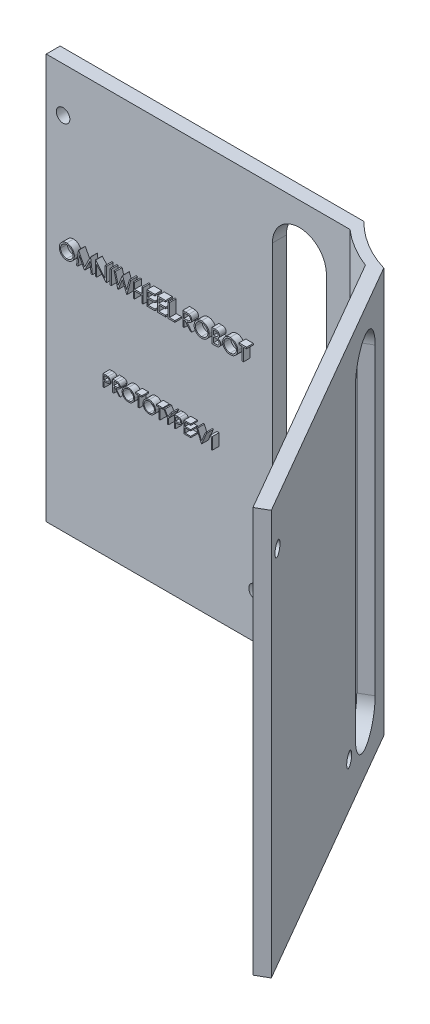
from build123d import *

# Parameters (mm, degrees)
BOSS_EXTRU_1_DEPTH      = 120
ENL_V_MAT_EXTRU_1_DEPTH = 188.009777727
ENL_V_MAT_EXTRU_2_DEPTH = 180.784310366
ESQUISSE6_R             = 2
ENL_V_MAT_EXTRU_3_DEPTH = 188.009777727
ESQUISSE7_R             = 2
ENL_V_MAT_EXTRU_4_DEPTH = 180.784310366
ESQUISSE8_W             = 0.379914529
ESQUISSE8_H             = 4.233333333
BOSS_EXTRU_2_DEPTH      = 2
ESQUISSE9_R             = 2
ENL_V_MAT_EXTRU_5_DEPTH = 188.009777853
ESQUISSE10_R            = 2
ENL_V_MAT_EXTRU_6_DEPTH = 180.784310483


with BuildPart() as part:
    # Esquisse3 → Boss.-Extru.1 (new body)
    with BuildSketch(Plane(origin=(0, 0, 0), x_dir=(1, 0, 0), z_dir=(0, 1, 0))):
        with BuildLine():
            ThreePointArc((-25, -28.618176043), (-27.104360033, -26.633694209), (-29.051678093, -24.494897428))
            Line((-29.051678093, -24.494897428), (-115, -24.494897428))
            Line((-115, -24.494897428), (-115, -28.618176043))
            Line((-115, -28.618176043), (-25, -28.618176043))
        make_face()
        with BuildLine():
            ThreePointArc((-10.103808925, -33.509894736), (-18.121448463, -29.943498553), (-25, -24.494897428))
            Line((-25, -24.494897428), (-29.051678093, -24.494897428))
            ThreePointArc((-29.051678093, -24.494897428), (-27.104360033, -26.633694209), (-25, -28.618176043))
            ThreePointArc((-25, -28.618176043), (-19.581111, -32.566548666), (-13.552631037, -35.50107311))
            ThreePointArc((-13.552631037, -35.50107311), (-10.809506446, -36.430132725), (-8.003591765, -37.147577564))
            Line((-8.003591765, -37.147577564), (-10.103808925, -33.509894736))
        make_face()
        with BuildLine():
            Line((35.411933246, -112.345472721), (-8.003591765, -37.147577564))
            ThreePointArc((-8.003591765, -37.147577564), (-10.809506446, -36.430132725), (-13.552631037, -35.50107311))
            Line((-13.552631037, -35.50107311), (31.963111135, -114.336651096))
            Line((31.963111135, -114.336651096), (35.411933246, -112.345472721))
        make_face()
    extrude(amount=BOSS_EXTRU_1_DEPTH)

    # Esquisse4 → Enlèv. mat.-Extru.1 (cut, through all)
    with BuildSketch(Plane.XY.offset(28.618176043)):
        with BuildLine():
            Line((-48, 105), (-48, 15))
            ThreePointArc((-48, 15), (-40, 7), (-32, 15))
            Line((-32, 15), (-32, 105))
            ThreePointArc((-32, 105), (-40, 113), (-48, 105))
        make_face()
    extrude(amount=-ENL_V_MAT_EXTRU_1_DEPTH, mode=Mode.SUBTRACT)

    # Esquisse5 → Enlèv. mat.-Extru.2 (cut, through all)
    with BuildSketch(Plane(origin=(-25.536888865, 0, 14.743729661), x_dir=(0.4999999999999999, 0, 0.8660254037844386), z_dir=(-0.8660254037844387, 0, 0.49999999999999994))):
        with BuildLine():
            Line((46.968515657, 105), (46.968515657, 15))
            ThreePointArc((46.968515657, 15), (38.968515657, 7), (30.968515657, 15))
            Line((30.968515657, 15), (30.968515657, 105))
            ThreePointArc((30.968515657, 105), (38.968515657, 113), (46.968515657, 105))
        make_face()
    extrude(amount=-ENL_V_MAT_EXTRU_2_DEPTH, mode=Mode.SUBTRACT)

    # Esquisse6 → Enlèv. mat.-Extru.3 (cut, through all)
    with BuildSketch(Plane.XY.offset(28.618176043)):
        with Locations((-110, 106.75)):
            Circle(ESQUISSE6_R)
    extrude(amount=-ENL_V_MAT_EXTRU_3_DEPTH, mode=Mode.SUBTRACT)

    # Esquisse7 → Enlèv. mat.-Extru.4 (cut, through all)
    with BuildSketch(Plane(origin=(-25.536888865, 0, 14.743729661), x_dir=(0.4999999999999999, 0, 0.8660254037844386), z_dir=(-0.8660254037844387, 0, 0.49999999999999994))):
        with Locations((110, 106.75)):
            Circle(ESQUISSE7_R)
    extrude(amount=-ENL_V_MAT_EXTRU_4_DEPTH, mode=Mode.SUBTRACT)

    # Esquisse8 → Boss.-Extru.2 (add)
    # profile 1 of 25: a face of its own
    with BuildSketch(Plane.XY.offset(28.618176043)):
        with BuildLine():
            add(Edge.make_bspline(
                [(-106.927136752, 76.562203816), (-106.848749805, 76.560218407), (-106.694791374, 76.556318902), (-106.468519831, 76.526468938), (-106.252504811, 76.474827848), (-106.044986643, 76.406050716), (-105.848447519, 76.314303031), (-105.661408096, 76.203407661), (-105.484313401, 76.072202802), (-105.319550397, 75.921702689), (-105.168774848, 75.757953178), (-105.035937823, 75.583203706), (-104.924610477, 75.398510869), (-104.833187668, 75.204429674), (-104.761464588, 75.001399046), (-104.71197203, 74.788336585), (-104.680357315, 74.566622779), (-104.67666128, 74.41539981), (-104.674786325, 74.338686188)],
                knots=[0, 0, 0, 0, 1.065120563, 2.091984664, 3.0946048, 4.079830382, 5.057816894, 6.036188127, 7.030412546, 8.04752943, 9.064399622, 10.05169764, 11.02544977, 11.989514704, 12.962713494, 13.945757189, 14.957906945, 16, 16, 16, 16], degree=3))
            add(Edge.make_bspline(
                [(-104.674786325, 74.338686188), (-104.676661005, 74.262537657), (-104.680356217, 74.112440082), (-104.712007977, 73.89213325), (-104.761648043, 73.680356883), (-104.832521622, 73.477464522), (-104.92350863, 73.283242136), (-105.035577265, 73.098200773), (-105.167586158, 72.92227977), (-105.317817302, 72.757406356), (-105.481588086, 72.606218939), (-105.657247552, 72.474478965), (-105.840845186, 72.361117405), (-106.034743595, 72.270664771), (-106.236371259, 72.19836921), (-106.447532735, 72.149077934), (-106.667238567, 72.117283129), (-106.817063496, 72.113632162), (-106.893215812, 72.111776465)],
                knots=[0, 0, 0, 0, 1.043624062, 2.057103931, 3.04512605, 4.022047818, 4.998200453, 5.980619268, 6.982898556, 8.009068085, 9.034988726, 10.034168286, 11.015286542, 11.987931943, 12.962482838, 13.94673481, 14.956375938, 16, 16, 16, 16], degree=3))
            add(Edge.make_bspline(
                [(-106.893215812, 72.111776465), (-106.969929036, 72.113650486), (-107.121151221, 72.117344679), (-107.343143635, 72.149011711), (-107.556355763, 72.198531193), (-107.760177883, 72.269299749), (-107.954723655, 72.36076059), (-108.140373565, 72.472283982), (-108.316382438, 72.604614524), (-108.481291027, 72.754796952), (-108.632178152, 72.918290163), (-108.763725207, 73.093470643), (-108.875273677, 73.276901528), (-108.966427422, 73.469091867), (-109.038593006, 73.669112564), (-109.087826453, 73.878297866), (-109.119680414, 74.095455173), (-109.123351133, 74.243310869), (-109.125213675, 74.318333624)],
                knots=[0, 0, 0, 0, 1.053102029, 2.075944431, 3.073151272, 4.055350789, 5.033113405, 6.020478099, 7.024410459, 8.052272461, 9.079885166, 10.07527673, 11.055994387, 12.023226415, 12.992069828, 13.970394897, 14.97016774, 16, 16, 16, 16], degree=3))
            add(Edge.make_bspline(
                [(-109.125213675, 74.318333624), (-109.124567021, 74.368689328), (-109.12328187, 74.468765478), (-109.107810013, 74.617375556), (-109.085359194, 74.763595685), (-109.053183547, 74.907010069), (-109.011102198, 75.047267641), (-108.961448793, 75.185335707), (-108.900803456, 75.319815068), (-108.832246863, 75.451342789), (-108.7557302, 75.577868542), (-108.671213817, 75.697465752), (-108.581666276, 75.811138006), (-108.483497219, 75.91593962), (-108.37994209, 76.014919375), (-108.269321004, 76.106556186), (-108.152308956, 76.191676364), (-108.028402459, 76.268384777), (-107.900654641, 76.337762016), (-107.768965586, 76.397297017), (-107.635123828, 76.448394634), (-107.498502492, 76.489809727), (-107.359464377, 76.522505618), (-107.217706028, 76.544769751), (-107.073340379, 76.560281069), (-106.976080974, 76.561560143), (-106.927136752, 76.562203816)],
                knots=[0, 0, 0, 0, 1.037015668, 2.060948919, 3.074880161, 4.083647147, 5.086022904, 6.090072063, 7.104153813, 8.122640571, 9.144368836, 10.147691507, 11.138137339, 12.123020368, 13.103399296, 14.087645067, 15.080126199, 16.082011238, 17.087798457, 18.072939717, 19.057185487, 20.037253025, 21.01195951, 21.997135196, 22.992090687, 24, 24, 24, 24], degree=3))
        make_face()
        with BuildLine():
            add(Edge.make_bspline(
                [(-106.908480235, 76.128015782), (-106.948654125, 76.127526057), (-107.02861784, 76.12655129), (-107.147495327, 76.11371133), (-107.26480938, 76.095411369), (-107.380584228, 76.069308005), (-107.494335454, 76.033743103), (-107.607123357, 75.992811719), (-107.717919432, 75.942953829), (-107.826357907, 75.886623034), (-107.93148376, 75.824273387), (-108.030680075, 75.755364678), (-108.124203654, 75.681512903), (-108.21182551, 75.602545709), (-108.293288356, 75.518060953), (-108.370195567, 75.429339435), (-108.439464489, 75.333845243), (-108.502947044, 75.234167894), (-108.559755765, 75.130437219), (-108.610271956, 75.02374529), (-108.651594138, 74.913221803), (-108.685294346, 74.800065822), (-108.713234117, 74.684456561), (-108.730934197, 74.56551701), (-108.743915241, 74.443844827), (-108.744834292, 74.361619156), (-108.745299145, 74.320029671)],
                knots=[0, 0, 0, 0, 1.008559885, 2.007477868, 2.99961109, 3.989939068, 4.984837346, 5.991145699, 7.001802488, 8.033829008, 9.059044045, 10.069351652, 11.065060232, 12.050310815, 13.029377138, 14.011219647, 14.996725999, 15.989392538, 16.977580475, 17.965360261, 18.951710183, 19.937753436, 20.929683414, 21.935841486, 22.955955122, 24, 24, 24, 24], degree=3))
            add(Edge.make_bspline(
                [(-108.745299145, 74.320029671), (-108.743757169, 74.258873461), (-108.740723626, 74.138560276), (-108.714165422, 73.962250236), (-108.673256939, 73.792810118), (-108.612953267, 73.631167047), (-108.537538714, 73.475931581), (-108.444372856, 73.328480826), (-108.333992819, 73.18877493), (-108.208609316, 73.057789224), (-108.071542804, 72.93823287), (-107.925997502, 72.833290461), (-107.773532662, 72.744499016), (-107.613750693, 72.672163357), (-107.447504622, 72.614844341), (-107.273723203, 72.575560664), (-107.093564076, 72.549706541), (-106.970760331, 72.547223684), (-106.908480235, 72.5459645)],
                knots=[0, 0, 0, 0, 1.032063989, 2.030389145, 3.003944642, 3.970395727, 4.937377036, 5.913328081, 6.909231446, 7.93887556, 8.970685674, 9.976071282, 10.964166581, 11.944589148, 12.933237628, 13.927779006, 14.949070134, 16, 16, 16, 16], degree=3))
            add(Edge.make_bspline(
                [(-106.908480235, 72.5459645), (-106.866619219, 72.546539633), (-106.783596251, 72.547680297), (-106.660109286, 72.559169172), (-106.538847011, 72.577592481), (-106.41997951, 72.604118131), (-106.303641691, 72.637316181), (-106.189347977, 72.676756004), (-106.078315759, 72.725960889), (-105.969144336, 72.780326506), (-105.864646025, 72.842302697), (-105.764889905, 72.908872649), (-105.672390386, 72.982615648), (-105.584834081, 73.060409573), (-105.503036781, 73.143822989), (-105.427551628, 73.232747448), (-105.358632802, 73.327744243), (-105.295174353, 73.427270401), (-105.238564692, 73.531284916), (-105.189241401, 73.638363669), (-105.147396575, 73.748242992), (-105.113616384, 73.861081369), (-105.087145397, 73.976664491), (-105.068905875, 74.095147118), (-105.056147287, 74.216292228), (-105.055185622, 74.298230035), (-105.054700855, 74.339534211)],
                knots=[0, 0, 0, 0, 1.047197238, 2.076906641, 3.100256066, 4.114471768, 5.12198147, 6.126382909, 7.136867548, 8.15857795, 9.17633901, 10.174870724, 11.156907918, 12.133735059, 13.104061851, 14.077631395, 15.04955518, 16.038496417, 17.029181396, 18.010275684, 18.986308667, 19.968651475, 20.955262928, 21.950658345, 22.966943676, 24, 24, 24, 24], degree=3))
            add(Edge.make_bspline(
                [(-105.054700855, 74.339534211), (-105.05518601, 74.380555821), (-105.056148406, 74.461929741), (-105.06889978, 74.582229969), (-105.087164667, 74.699860044), (-105.11348718, 74.814358167), (-105.147414509, 74.925753526), (-105.189248709, 75.033941497), (-105.238579499, 75.139325124), (-105.295195161, 75.24164394), (-105.358835252, 75.339826718), (-105.428375909, 75.433688684), (-105.505017806, 75.521467142), (-105.586571188, 75.605329106), (-105.675073116, 75.683485982), (-105.770122691, 75.755963697), (-105.870565997, 75.824511372), (-105.976916081, 75.886348956), (-106.086673054, 75.943455695), (-106.199296603, 75.992382146), (-106.313510847, 76.033956043), (-106.429025345, 76.06941561), (-106.546812376, 76.095309132), (-106.666076055, 76.113727821), (-106.786651377, 76.126546821), (-106.867741748, 76.127524574), (-106.908480235, 76.128015782)],
                knots=[0, 0, 0, 0, 1.02996197, 2.043119294, 3.035359645, 4.018872909, 4.991431989, 5.957985074, 6.929999688, 7.912076566, 8.892894881, 9.867085534, 10.843653904, 11.817741046, 12.803660682, 13.806313499, 14.818574707, 15.856120519, 16.894564902, 17.924820532, 18.937903209, 19.946497019, 20.957711757, 21.963978472, 22.977135795, 24, 24, 24, 24], degree=3))
        make_face(mode=Mode.SUBTRACT)
    # profile 2 of 25: a face of its own
    with BuildSketch(Plane.XY.offset(28.618176043)):
        Polygon((-104.023504274, 72.220323474), (-103.464656784, 76.453656807), (-103.41038328, 76.453656807), (-101.662606838, 72.980152534), (-99.919070513, 76.453656807), (-99.863948985, 76.453656807), (-99.301709402, 72.220323474), (-99.683319979, 72.220323474), (-100.088675214, 75.266423901), (-101.616813568, 72.220323474), (-101.702463942, 72.220323474), (-103.236538462, 75.273208089), (-103.641045673, 72.220323474), align=None)
    # profile 3 of 25: a face of its own
    with BuildSketch(Plane.XY.offset(28.618176043)):
        Polygon((-98.433333333, 72.220323474), (-98.433333333, 76.453656807), (-98.353619124, 76.453656807), (-95.556837607, 73.121772459), (-95.556837607, 76.453656807), (-95.176923077, 76.453656807), (-95.176923077, 72.220323474), (-95.263421474, 72.220323474), (-98.053418803, 75.544575611), (-98.053418803, 72.220323474), align=None)
    # profile 4 of 25: a face of its own
    with BuildSketch(Plane.XY.offset(28.618176043)):
        with Locations((-93.901495727, 74.336990141)):
            Rectangle(ESQUISSE8_W, ESQUISSE8_H)
    # profile 5 of 25: a face of its own
    with BuildSketch(Plane.XY.offset(28.618176043)):
        Polygon((-92.897435897, 76.453656807), (-92.504801015, 76.453656807), (-91.676282051, 73.349042758), (-90.4441039, 76.453656807), (-90.388982372, 76.453656807), (-89.179700855, 73.370243346), (-88.346941774, 76.453656807), (-87.958547009, 76.453656807), (-89.099986645, 72.220323474), (-89.15426015, 72.220323474), (-90.427991453, 75.458077213), (-91.716987179, 72.220323474), (-91.771260684, 72.220323474), align=None)
    # profile 6 of 25: a face of its own
    with BuildSketch(Plane.XY.offset(28.618176043)):
        Polygon((-87.198717949, 76.453656807), (-86.818803419, 76.453656807), (-86.818803419, 74.716904671), (-84.647863248, 74.716904671), (-84.647863248, 76.453656807), (-84.267948718, 76.453656807), (-84.267948718, 72.220323474), (-84.647863248, 72.220323474), (-84.647863248, 74.282716636), (-86.818803419, 74.282716636), (-86.818803419, 72.220323474), (-87.198717949, 72.220323474), align=None)
    # profile 7 of 25: a face of its own
    with BuildSketch(Plane.XY.offset(28.618176043)):
        Polygon((-83.182478632, 76.453656807), (-80.794444444, 76.453656807), (-80.794444444, 76.019468773), (-82.802564103, 76.019468773), (-82.802564103, 74.716904671), (-80.794444444, 74.716904671), (-80.794444444, 74.282716636), (-82.802564103, 74.282716636), (-82.802564103, 72.654511508), (-80.794444444, 72.654511508), (-80.794444444, 72.220323474), (-83.182478632, 72.220323474), align=None)
    # profile 8 of 25: a face of its own
    with BuildSketch(Plane.XY.offset(28.618176043)):
        Polygon((-80.034615385, 76.453656807), (-77.646581197, 76.453656807), (-77.646581197, 76.019468773), (-79.654700855, 76.019468773), (-79.654700855, 74.716904671), (-77.646581197, 74.716904671), (-77.646581197, 74.282716636), (-79.654700855, 74.282716636), (-79.654700855, 72.654511508), (-77.646581197, 72.654511508), (-77.646581197, 72.220323474), (-80.034615385, 72.220323474), align=None)
    # profile 9 of 25: a face of its own
    with BuildSketch(Plane.XY.offset(28.618176043)):
        Polygon((-76.886752137, 76.453656807), (-76.506837607, 76.453656807), (-76.506837607, 72.654511508), (-74.878632479, 72.654511508), (-74.878632479, 72.220323474), (-76.886752137, 72.220323474), align=None)
    # profile 10 of 25: a face of its own
    with BuildSketch(Plane.XY.offset(28.618176043)):
        with BuildLine():
            Line((-72.544871795, 76.453656807), (-71.697696314, 76.453656807))
            add(Edge.make_bspline(
                [(-71.697696314, 76.453656807), (-71.641161806, 76.453468622), (-71.532609289, 76.453107286), (-71.377096857, 76.451092506), (-71.235791702, 76.44531781), (-71.108767705, 76.44034838), (-70.996027199, 76.431286699), (-70.897224476, 76.422625725), (-70.812814594, 76.41128806), (-70.761717231, 76.400758643), (-70.738581731, 76.395991209)],
                knots=[0, 0, 0, 0, 1.410062039, 2.707475311, 3.878576406, 4.937260626, 5.877586885, 6.699081471, 7.410979367, 8, 8, 8, 8], degree=3))
            add(Edge.make_bspline(
                [(-70.738581731, 76.395991209), (-70.707609909, 76.388338836), (-70.646326979, 76.373197335), (-70.558092137, 76.341193818), (-70.474012907, 76.304158653), (-70.394438548, 76.260659677), (-70.319767639, 76.210373991), (-70.249230254, 76.15416969), (-70.182506312, 76.092354308), (-70.122294245, 76.023369309), (-70.065520345, 75.950995626), (-70.017636958, 75.872734892), (-69.976360169, 75.790896663), (-69.943496781, 75.704648644), (-69.917034851, 75.614827262), (-69.898376448, 75.520618908), (-69.887186916, 75.422452776), (-69.886047719, 75.355496068), (-69.885470085, 75.321545429)],
                knots=[0, 0, 0, 0, 1.027469482, 2.033020251, 3.019912614, 3.986113645, 4.951240523, 5.91722682, 6.890402269, 7.87763091, 8.8651537, 9.85103654, 10.82876324, 11.815024772, 12.821070561, 13.842952187, 14.906261191, 16, 16, 16, 16], degree=3))
            add(Edge.make_bspline(
                [(-69.885470085, 75.321545429), (-69.887246874, 75.26513916), (-69.890713848, 75.155075919), (-69.923038497, 74.995345138), (-69.97598724, 74.846344729), (-70.048949694, 74.7082623), (-70.141864679, 74.583789425), (-70.253533712, 74.474460017), (-70.38401909, 74.382971741), (-70.505490739, 74.319528825), (-70.612792675, 74.278897402), (-70.701128206, 74.250308664), (-70.797487312, 74.228220382), (-70.900946755, 74.208432413), (-71.011937081, 74.193492744), (-71.130192272, 74.182550673), (-71.255796665, 74.175711967), (-71.342082967, 74.174693542), (-71.386471688, 74.174169628)],
                knots=[0, 0, 0, 0, 1.260483769, 2.459530307, 3.627416485, 4.787058657, 5.939039949, 7.08810263, 8.267026773, 9.491475466, 10.141966685, 10.831826277, 11.566392101, 12.351337768, 13.187381173, 14.07005841, 15.007169909, 16, 16, 16, 16], degree=3))
            Line((-71.386471688, 74.174169628), (-69.831196581, 72.220323474))
            Line((-69.831196581, 72.220323474), (-70.301001603, 72.220323474))
            Line((-70.301001603, 72.220323474), (-71.856276709, 74.174169628))
            Line((-71.856276709, 74.174169628), (-72.164957265, 74.174169628))
            Line((-72.164957265, 74.174169628), (-72.164957265, 72.220323474))
            Line((-72.164957265, 72.220323474), (-72.544871795, 72.220323474))
            Line((-72.544871795, 72.220323474), (-72.544871795, 76.453656807))
        make_face()
        with BuildLine():
            Line((-72.164957265, 76.019468773), (-72.164957265, 74.608357662))
            Line((-72.164957265, 74.608357662), (-71.389863782, 74.602421497))
            add(Edge.make_bspline(
                [(-71.389863782, 74.602421497), (-71.353674783, 74.602405487), (-71.283530194, 74.602374455), (-71.182050343, 74.607205023), (-71.087562208, 74.612700274), (-71.000427203, 74.621105673), (-70.920606402, 74.631938255), (-70.848139702, 74.645488531), (-70.782908811, 74.661275312), (-70.706831531, 74.685709659), (-70.621878774, 74.724421701), (-70.529554056, 74.78074378), (-70.450932181, 74.851584524), (-70.384507719, 74.932590514), (-70.331132121, 75.02165531), (-70.29350135, 75.117711299), (-70.269622396, 75.218333518), (-70.266805965, 75.287491801), (-70.265384615, 75.322393453)],
                knots=[0, 0, 0, 0, 1.146690395, 2.22261258, 3.21895312, 4.145990853, 4.996080663, 5.770904154, 6.481378293, 7.121626537, 8.300444488, 9.431385265, 10.535395872, 11.636531494, 12.74115979, 13.810798291, 14.895190096, 16, 16, 16, 16], degree=3))
            add(Edge.make_bspline(
                [(-70.265384615, 75.322393453), (-70.266838609, 75.356437404), (-70.269719895, 75.423900092), (-70.293243644, 75.52266486), (-70.333024134, 75.615879171), (-70.386632936, 75.703163834), (-70.451946199, 75.782394581), (-70.528530601, 75.850184947), (-70.614292123, 75.906124776), (-70.694448715, 75.941871503), (-70.766093906, 75.963787897), (-70.828299304, 75.979210733), (-70.89858652, 75.991601662), (-70.977296837, 76.001529507), (-71.064094238, 76.01006263), (-71.159417597, 76.01581002), (-71.262634464, 76.019213455), (-71.334174086, 76.019381687), (-71.371207265, 76.019468773)],
                knots=[0, 0, 0, 0, 1.101028733, 2.181837193, 3.264309656, 4.369019818, 5.486613113, 6.575447106, 7.666700264, 8.788928104, 9.402425223, 10.0903467, 10.862060571, 11.710948788, 12.657782767, 13.684531032, 14.801375019, 16, 16, 16, 16], degree=3))
            Line((-71.371207265, 76.019468773), (-72.164957265, 76.019468773))
        make_face(mode=Mode.SUBTRACT)
    # profile 11 of 25: a face of its own
    with BuildSketch(Plane.XY.offset(28.618176043)):
        with BuildLine():
            add(Edge.make_bspline(
                [(-66.981837607, 76.562203816), (-66.90345066, 76.560218407), (-66.749492228, 76.556318902), (-66.523220685, 76.526468938), (-66.307205665, 76.474827848), (-66.099687497, 76.406050716), (-65.903148373, 76.314303031), (-65.716108951, 76.203407661), (-65.539014256, 76.072202802), (-65.374251252, 75.921702689), (-65.223475702, 75.757953178), (-65.090638678, 75.583203706), (-64.979311332, 75.398510869), (-64.887888523, 75.204429674), (-64.816165443, 75.001399046), (-64.766672885, 74.788336585), (-64.73505817, 74.566622779), (-64.731362135, 74.41539981), (-64.729487179, 74.338686188)],
                knots=[0, 0, 0, 0, 1.065120563, 2.091984664, 3.0946048, 4.079830382, 5.057816894, 6.036188127, 7.030412546, 8.04752943, 9.064399622, 10.05169764, 11.02544977, 11.989514704, 12.962713494, 13.945757189, 14.957906945, 16, 16, 16, 16], degree=3))
            add(Edge.make_bspline(
                [(-64.729487179, 74.338686188), (-64.73136186, 74.262537657), (-64.735057072, 74.112440082), (-64.766708831, 73.89213325), (-64.816348898, 73.680356883), (-64.887222477, 73.477464522), (-64.978209484, 73.283242136), (-65.09027812, 73.098200773), (-65.222287013, 72.92227977), (-65.372518157, 72.757406356), (-65.536288941, 72.606218939), (-65.711948406, 72.474478965), (-65.895546041, 72.361117405), (-66.08944445, 72.270664771), (-66.291072113, 72.19836921), (-66.50223359, 72.149077934), (-66.721939422, 72.117283129), (-66.87176435, 72.113632162), (-66.947916667, 72.111776465)],
                knots=[0, 0, 0, 0, 1.043624062, 2.057103931, 3.04512605, 4.022047818, 4.998200453, 5.980619268, 6.982898556, 8.009068085, 9.034988726, 10.034168286, 11.015286542, 11.987931943, 12.962482838, 13.94673481, 14.956375938, 16, 16, 16, 16], degree=3))
            add(Edge.make_bspline(
                [(-66.947916667, 72.111776465), (-67.024629891, 72.113650486), (-67.175852076, 72.117344679), (-67.39784449, 72.149011711), (-67.611056618, 72.198531193), (-67.814878738, 72.269299749), (-68.00942451, 72.36076059), (-68.19507442, 72.472283982), (-68.371083293, 72.604614524), (-68.535991882, 72.754796952), (-68.686879007, 72.918290163), (-68.818426061, 73.093470643), (-68.929974532, 73.276901528), (-69.021128277, 73.469091867), (-69.093293861, 73.669112564), (-69.142527308, 73.878297866), (-69.174381269, 74.095455173), (-69.178051988, 74.243310869), (-69.17991453, 74.318333624)],
                knots=[0, 0, 0, 0, 1.053102029, 2.075944431, 3.073151272, 4.055350789, 5.033113405, 6.020478099, 7.024410459, 8.052272461, 9.079885166, 10.07527673, 11.055994387, 12.023226415, 12.992069828, 13.970394897, 14.97016774, 16, 16, 16, 16], degree=3))
            add(Edge.make_bspline(
                [(-69.17991453, 74.318333624), (-69.179267876, 74.368689328), (-69.177982725, 74.468765478), (-69.162510868, 74.617375556), (-69.140060048, 74.763595685), (-69.107884402, 74.907010069), (-69.065803052, 75.047267641), (-69.016149648, 75.185335707), (-68.955504311, 75.319815068), (-68.886947718, 75.451342789), (-68.810431055, 75.577868542), (-68.725914672, 75.697465752), (-68.636367131, 75.811138006), (-68.538198074, 75.91593962), (-68.434642945, 76.014919375), (-68.324021859, 76.106556186), (-68.207009811, 76.191676364), (-68.083103314, 76.268384777), (-67.955355495, 76.337762016), (-67.82366644, 76.397297017), (-67.689824683, 76.448394634), (-67.553203346, 76.489809727), (-67.414165232, 76.522505618), (-67.272406883, 76.544769751), (-67.128041234, 76.560281069), (-67.030781829, 76.561560143), (-66.981837607, 76.562203816)],
                knots=[0, 0, 0, 0, 1.037015668, 2.060948919, 3.074880161, 4.083647147, 5.086022904, 6.090072063, 7.104153813, 8.122640571, 9.144368836, 10.147691507, 11.138137339, 12.123020368, 13.103399296, 14.087645067, 15.080126199, 16.082011238, 17.087798457, 18.072939717, 19.057185487, 20.037253025, 21.01195951, 21.997135196, 22.992090687, 24, 24, 24, 24], degree=3))
        make_face()
        with BuildLine():
            add(Edge.make_bspline(
                [(-66.96318109, 76.128015782), (-67.00335498, 76.127526057), (-67.083318695, 76.12655129), (-67.202196182, 76.11371133), (-67.319510235, 76.095411369), (-67.435285082, 76.069308005), (-67.549036309, 76.033743103), (-67.661824212, 75.992811719), (-67.772620287, 75.942953829), (-67.881058762, 75.886623034), (-67.986184615, 75.824273387), (-68.08538093, 75.755364678), (-68.178904509, 75.681512903), (-68.266526365, 75.602545709), (-68.347989211, 75.518060953), (-68.424896422, 75.429339435), (-68.494165344, 75.333845243), (-68.557647899, 75.234167894), (-68.61445662, 75.130437219), (-68.664972811, 75.02374529), (-68.706294993, 74.913221803), (-68.739995201, 74.800065822), (-68.767934972, 74.684456561), (-68.785635051, 74.56551701), (-68.798616096, 74.443844827), (-68.799535147, 74.361619156), (-68.8, 74.320029671)],
                knots=[0, 0, 0, 0, 1.008559885, 2.007477868, 2.99961109, 3.989939068, 4.984837346, 5.991145699, 7.001802488, 8.033829008, 9.059044045, 10.069351652, 11.065060232, 12.050310815, 13.029377138, 14.011219647, 14.996725999, 15.989392538, 16.977580475, 17.965360261, 18.951710183, 19.937753436, 20.929683414, 21.935841486, 22.955955122, 24, 24, 24, 24], degree=3))
            add(Edge.make_bspline(
                [(-68.8, 74.320029671), (-68.798458024, 74.258873461), (-68.795424481, 74.138560276), (-68.768866277, 73.962250236), (-68.727957793, 73.792810118), (-68.667654121, 73.631167047), (-68.592239569, 73.475931581), (-68.499073711, 73.328480826), (-68.388693674, 73.18877493), (-68.26331017, 73.057789224), (-68.126243659, 72.93823287), (-67.980698357, 72.833290461), (-67.828233517, 72.744499016), (-67.668451548, 72.672163357), (-67.502205477, 72.614844341), (-67.328424058, 72.575560664), (-67.148264931, 72.549706541), (-67.025461186, 72.547223684), (-66.96318109, 72.5459645)],
                knots=[0, 0, 0, 0, 1.032063989, 2.030389145, 3.003944642, 3.970395727, 4.937377036, 5.913328081, 6.909231446, 7.93887556, 8.970685674, 9.976071282, 10.964166581, 11.944589148, 12.933237628, 13.927779006, 14.949070134, 16, 16, 16, 16], degree=3))
            add(Edge.make_bspline(
                [(-66.96318109, 72.5459645), (-66.921320074, 72.546539633), (-66.838297106, 72.547680297), (-66.714810141, 72.559169172), (-66.593547865, 72.577592481), (-66.474680365, 72.604118131), (-66.358342546, 72.637316181), (-66.244048831, 72.676756004), (-66.133016613, 72.725960889), (-66.023845191, 72.780326506), (-65.919346879, 72.842302697), (-65.819590759, 72.908872649), (-65.727091241, 72.982615648), (-65.639534935, 73.060409573), (-65.557737635, 73.143822989), (-65.482252483, 73.232747448), (-65.413333656, 73.327744243), (-65.349875208, 73.427270401), (-65.293265547, 73.531284916), (-65.243942256, 73.638363669), (-65.20209743, 73.748242992), (-65.168317238, 73.861081369), (-65.141846251, 73.976664491), (-65.123606729, 74.095147118), (-65.110848142, 74.216292228), (-65.109886477, 74.298230035), (-65.109401709, 74.339534211)],
                knots=[0, 0, 0, 0, 1.047197238, 2.076906641, 3.100256066, 4.114471768, 5.12198147, 6.126382909, 7.136867548, 8.15857795, 9.17633901, 10.174870724, 11.156907918, 12.133735059, 13.104061851, 14.077631395, 15.04955518, 16.038496417, 17.029181396, 18.010275684, 18.986308667, 19.968651475, 20.955262928, 21.950658345, 22.966943676, 24, 24, 24, 24], degree=3))
            add(Edge.make_bspline(
                [(-65.109401709, 74.339534211), (-65.109886865, 74.380555821), (-65.110849261, 74.461929741), (-65.123600635, 74.582229969), (-65.141865521, 74.699860044), (-65.168188035, 74.814358167), (-65.202115364, 74.925753526), (-65.243949563, 75.033941497), (-65.293280354, 75.139325124), (-65.349896016, 75.24164394), (-65.413536107, 75.339826718), (-65.483076763, 75.433688684), (-65.559718661, 75.521467142), (-65.641272043, 75.605329106), (-65.729773971, 75.683485982), (-65.824823546, 75.755963697), (-65.925266851, 75.824511372), (-66.031616936, 75.886348956), (-66.141373909, 75.943455695), (-66.253997458, 75.992382146), (-66.368211702, 76.033956043), (-66.4837262, 76.06941561), (-66.601513231, 76.095309132), (-66.72077691, 76.113727821), (-66.841352232, 76.126546821), (-66.922442602, 76.127524574), (-66.96318109, 76.128015782)],
                knots=[0, 0, 0, 0, 1.02996197, 2.043119294, 3.035359645, 4.018872909, 4.991431989, 5.957985074, 6.929999688, 7.912076566, 8.892894881, 9.867085534, 10.843653904, 11.817741046, 12.803660682, 13.806313499, 14.818574707, 15.856120519, 16.894564902, 17.924820532, 18.937903209, 19.946497019, 20.957711757, 21.963978472, 22.977135795, 24, 24, 24, 24], degree=3))
        make_face(mode=Mode.SUBTRACT)
    # profile 12 of 25: a face of its own
    with BuildSketch(Plane.XY.offset(28.618176043)):
        with BuildLine():
            Line((-63.861111111, 76.453656807), (-63.035136218, 76.453656807))
            add(Edge.make_bspline(
                [(-63.035136218, 76.453656807), (-62.994703678, 76.453444233), (-62.916335352, 76.453032211), (-62.802374694, 76.446642138), (-62.695635656, 76.437929128), (-62.596087284, 76.424104159), (-62.503775577, 76.407422676), (-62.41842234, 76.387221432), (-62.340298988, 76.362998766), (-62.247029298, 76.32447993), (-62.140687165, 76.267241431), (-62.025542442, 76.182661167), (-61.927082077, 76.079207616), (-61.842190055, 75.962509547), (-61.774697272, 75.834135804), (-61.725869646, 75.697146119), (-61.694956787, 75.553307441), (-61.691777633, 75.454558073), (-61.69017094, 75.404651733)],
                knots=[0, 0, 0, 0, 1.001505555, 1.941167018, 2.826882275, 3.653841531, 4.429895133, 5.150066043, 5.825578002, 6.45369114, 7.647487171, 8.808567382, 9.977351308, 11.170798116, 12.373658725, 13.556498008, 14.765093433, 16, 16, 16, 16], degree=3))
            add(Edge.make_bspline(
                [(-61.69017094, 75.404651733), (-61.691493214, 75.357900546), (-61.694091606, 75.266030056), (-61.718938563, 75.131659086), (-61.757837657, 75.003750469), (-61.811909721, 74.882771012), (-61.882185468, 74.771454166), (-61.965471244, 74.668901949), (-62.065954615, 74.579456384), (-62.141239296, 74.529451159), (-62.179480502, 74.504050771)],
                knots=[0, 0, 0, 0, 1.044552857, 2.05264487, 3.044412934, 4.028983338, 5.005914585, 5.980388656, 6.974128949, 8, 8, 8, 8], degree=3))
            add(Edge.make_bspline(
                [(-62.179480502, 74.504050771), (-62.131389318, 74.485587391), (-62.039378971, 74.450262372), (-61.912758746, 74.387808049), (-61.803665933, 74.319878639), (-61.711261766, 74.245696306), (-61.632234317, 74.165736126), (-61.563227426, 74.078825654), (-61.504346145, 73.983831157), (-61.453893371, 73.881743071), (-61.414524875, 73.773603819), (-61.385041638, 73.660427737), (-61.368147676, 73.542620656), (-61.365743577, 73.462446912), (-61.364529915, 73.42197278)],
                knots=[0, 0, 0, 0, 1.27268992, 2.434971085, 3.483601985, 4.442670788, 5.356604649, 6.2567628, 7.179492994, 8.113709626, 9.066344395, 10.018646069, 10.999752585, 12, 12, 12, 12], degree=3))
            add(Edge.make_bspline(
                [(-61.364529915, 73.42197278), (-61.365711433, 73.380647134), (-61.368036104, 73.299337769), (-61.385187117, 73.179891083), (-61.414226704, 73.065742338), (-61.454227043, 72.956153212), (-61.50643289, 72.851335716), (-61.569966714, 72.751171101), (-61.645721081, 72.656665768), (-61.730463789, 72.566769577), (-61.826333241, 72.485939777), (-61.929766583, 72.413954112), (-62.042066418, 72.354752685), (-62.161388353, 72.305021878), (-62.289070907, 72.267034124), (-62.424540727, 72.240457772), (-62.567680978, 72.222550727), (-62.665906106, 72.221078489), (-62.71627938, 72.220323474)],
                knots=[0, 0, 0, 0, 0.978564426, 1.925352924, 2.850884081, 3.763762016, 4.682927383, 5.618979971, 6.567305752, 7.547517671, 8.540179244, 9.531824382, 10.526200242, 11.540722885, 12.589160233, 13.674978461, 14.80764778, 16, 16, 16, 16], degree=3))
            Line((-62.71627938, 72.220323474), (-63.861111111, 72.220323474))
            Line((-63.861111111, 72.220323474), (-63.861111111, 76.453656807))
        make_face()
        with BuildLine():
            Line((-63.481196581, 76.019468773), (-63.481196581, 74.662631166))
            Line((-63.481196581, 74.662631166), (-63.225941506, 74.662631166))
            add(Edge.make_bspline(
                [(-63.225941506, 74.662631166), (-63.188629154, 74.663114883), (-63.116534085, 74.664049521), (-63.012128115, 74.666726823), (-62.915214998, 74.674223504), (-62.825962019, 74.68171803), (-62.744509729, 74.693903484), (-62.671038583, 74.708408242), (-62.604395518, 74.723748518), (-62.527542925, 74.749837326), (-62.440368977, 74.788394133), (-62.347437508, 74.848231497), (-62.265511055, 74.919501905), (-62.196329694, 75.001738592), (-62.139710106, 75.092291026), (-62.100383994, 75.189714396), (-62.073717278, 75.291580651), (-62.071308474, 75.361513204), (-62.07008547, 75.397019521)],
                knots=[0, 0, 0, 0, 1.156816544, 2.235205308, 3.236616184, 4.169592532, 5.011045266, 5.787822928, 6.49130361, 7.128639758, 8.301311294, 9.436451833, 10.541879658, 11.654887649, 12.756523258, 13.837046038, 14.901820046, 16, 16, 16, 16], degree=3))
            add(Edge.make_bspline(
                [(-62.07008547, 75.397019521), (-62.070721898, 75.420515454), (-62.07197032, 75.466605293), (-62.08219479, 75.533793559), (-62.099572714, 75.596983622), (-62.121893621, 75.65704145), (-62.153085654, 75.712089117), (-62.189810986, 75.764029935), (-62.234183201, 75.811095068), (-62.284689665, 75.855084843), (-62.342757238, 75.894085367), (-62.408351276, 75.928243242), (-62.482359229, 75.955748753), (-62.563533825, 75.979837814), (-62.653124569, 75.996756988), (-62.7500976, 76.010852038), (-62.855247212, 76.018027831), (-62.927994146, 76.018977746), (-62.965598291, 76.019468773)],
                knots=[0, 0, 0, 0, 0.91205012, 1.789085906, 2.630437955, 3.453916878, 4.269457761, 5.079663411, 5.91843418, 6.774407191, 7.675494373, 8.627863946, 9.638891023, 10.736472738, 11.911756761, 13.175263542, 14.539845004, 16, 16, 16, 16], degree=3))
            Line((-62.965598291, 76.019468773), (-63.481196581, 76.019468773))
        make_face(mode=Mode.SUBTRACT)
        with BuildLine():
            Line((-63.481196581, 74.228443132), (-63.481196581, 72.654511508))
            Line((-63.481196581, 72.654511508), (-62.940157585, 72.654511508))
            add(Edge.make_bspline(
                [(-62.940157585, 72.654511508), (-62.901429932, 72.65497566), (-62.826787486, 72.655870251), (-62.719017427, 72.658790712), (-62.619131197, 72.66543375), (-62.527584594, 72.675891111), (-62.443389094, 72.687234569), (-62.36755473, 72.702488213), (-62.299466772, 72.719964575), (-62.220515943, 72.746978288), (-62.131611699, 72.788944496), (-62.035804283, 72.852219798), (-61.950622095, 72.927601323), (-61.87828621, 73.014845381), (-61.819003833, 73.109709938), (-61.775877711, 73.210276219), (-61.749279247, 73.314882523), (-61.746059289, 73.386204166), (-61.744444444, 73.42197278)],
                knots=[0, 0, 0, 0, 1.160039823, 2.235823828, 3.228722157, 4.157150951, 4.99529583, 5.772374946, 6.472645482, 7.099169577, 8.269452708, 9.405989375, 10.527446681, 11.663510218, 12.788923519, 13.866172445, 14.929861265, 16, 16, 16, 16], degree=3))
            add(Edge.make_bspline(
                [(-61.744444444, 73.42197278), (-61.744778399, 73.444340915), (-61.745440922, 73.488716386), (-61.755432332, 73.553928854), (-61.769963394, 73.617097291), (-61.788749033, 73.678393224), (-61.816107817, 73.736708451), (-61.848047162, 73.793196309), (-61.885495714, 73.84793147), (-61.943848182, 73.917131052), (-62.028722868, 73.996859249), (-62.149320587, 74.074918895), (-62.28644708, 74.137871956), (-62.385903191, 74.164601799), (-62.437279647, 74.178409745)],
                knots=[0, 0, 0, 0, 0.723448775, 1.435228256, 2.130040452, 2.821711965, 3.505591119, 4.210454504, 4.921174351, 5.648778258, 7.137944449, 8.670945889, 10.280296675, 12, 12, 12, 12], degree=3))
            add(Edge.make_bspline(
                [(-62.437279647, 74.178409745), (-62.457876744, 74.182588752), (-62.502535499, 74.191649699), (-62.575358001, 74.201214255), (-62.658495671, 74.209735423), (-62.752140484, 74.216038442), (-62.856410921, 74.222553594), (-62.97152967, 74.22508733), (-63.097026612, 74.228110245), (-63.184103101, 74.228329331), (-63.2293336, 74.228443132)],
                knots=[0, 0, 0, 0, 0.634451884, 1.375622551, 2.216452059, 3.157844607, 4.20941857, 5.370758133, 6.634282058, 8, 8, 8, 8], degree=3))
            Line((-63.2293336, 74.228443132), (-63.481196581, 74.228443132))
        make_face(mode=Mode.SUBTRACT)
    # profile 13 of 25: a face of its own
    with BuildSketch(Plane.XY.offset(28.618176043)):
        with BuildLine():
            add(Edge.make_bspline(
                [(-58.51517094, 76.562203816), (-58.436783993, 76.560218407), (-58.282825562, 76.556318902), (-58.056554019, 76.526468938), (-57.840538999, 76.474827848), (-57.633020831, 76.406050716), (-57.436481707, 76.314303031), (-57.249442284, 76.203407661), (-57.072347589, 76.072202802), (-56.907584585, 75.921702689), (-56.756809036, 75.757953178), (-56.623972011, 75.583203706), (-56.512644666, 75.398510869), (-56.421221856, 75.204429674), (-56.349498776, 75.001399046), (-56.300006218, 74.788336585), (-56.268391503, 74.566622779), (-56.264695468, 74.41539981), (-56.262820513, 74.338686188)],
                knots=[0, 0, 0, 0, 1.065120563, 2.091984664, 3.0946048, 4.079830382, 5.057816894, 6.036188127, 7.030412546, 8.04752943, 9.064399622, 10.05169764, 11.02544977, 11.989514704, 12.962713494, 13.945757189, 14.957906945, 16, 16, 16, 16], degree=3))
            add(Edge.make_bspline(
                [(-56.262820513, 74.338686188), (-56.264695193, 74.262537657), (-56.268390405, 74.112440082), (-56.300042165, 73.89213325), (-56.349682231, 73.680356883), (-56.42055581, 73.477464522), (-56.511542818, 73.283242136), (-56.623611453, 73.098200773), (-56.755620346, 72.92227977), (-56.90585149, 72.757406356), (-57.069622274, 72.606218939), (-57.24528174, 72.474478965), (-57.428879374, 72.361117405), (-57.622777783, 72.270664771), (-57.824405447, 72.19836921), (-58.035566923, 72.149077934), (-58.255272755, 72.117283129), (-58.405097684, 72.113632162), (-58.48125, 72.111776465)],
                knots=[0, 0, 0, 0, 1.043624062, 2.057103931, 3.04512605, 4.022047818, 4.998200453, 5.980619268, 6.982898556, 8.009068085, 9.034988726, 10.034168286, 11.015286542, 11.987931943, 12.962482838, 13.94673481, 14.956375938, 16, 16, 16, 16], degree=3))
            add(Edge.make_bspline(
                [(-58.48125, 72.111776465), (-58.557963224, 72.113650486), (-58.709185409, 72.117344679), (-58.931177823, 72.149011711), (-59.144389951, 72.198531193), (-59.348212071, 72.269299749), (-59.542757843, 72.36076059), (-59.728407753, 72.472283982), (-59.904416626, 72.604614524), (-60.069325215, 72.754796952), (-60.22021234, 72.918290163), (-60.351759395, 73.093470643), (-60.463307865, 73.276901528), (-60.55446161, 73.469091867), (-60.626627194, 73.669112564), (-60.675860641, 73.878297866), (-60.707714602, 74.095455173), (-60.711385321, 74.243310869), (-60.713247863, 74.318333624)],
                knots=[0, 0, 0, 0, 1.053102029, 2.075944431, 3.073151272, 4.055350789, 5.033113405, 6.020478099, 7.024410459, 8.052272461, 9.079885166, 10.07527673, 11.055994387, 12.023226415, 12.992069828, 13.970394897, 14.97016774, 16, 16, 16, 16], degree=3))
            add(Edge.make_bspline(
                [(-60.713247863, 74.318333624), (-60.712601209, 74.368689328), (-60.711316058, 74.468765478), (-60.695844201, 74.617375556), (-60.673393382, 74.763595685), (-60.641217735, 74.907010069), (-60.599136386, 75.047267641), (-60.549482981, 75.185335707), (-60.488837644, 75.319815068), (-60.420281051, 75.451342789), (-60.343764388, 75.577868542), (-60.259248005, 75.697465752), (-60.169700464, 75.811138006), (-60.071531407, 75.91593962), (-59.967976278, 76.014919375), (-59.857355192, 76.106556186), (-59.740343144, 76.191676364), (-59.616436647, 76.268384777), (-59.488688829, 76.337762016), (-59.356999774, 76.397297017), (-59.223158016, 76.448394634), (-59.08653668, 76.489809727), (-58.947498565, 76.522505618), (-58.805740216, 76.544769751), (-58.661374567, 76.560281069), (-58.564115162, 76.561560143), (-58.51517094, 76.562203816)],
                knots=[0, 0, 0, 0, 1.037015668, 2.060948919, 3.074880161, 4.083647147, 5.086022904, 6.090072063, 7.104153813, 8.122640571, 9.144368836, 10.147691507, 11.138137339, 12.123020368, 13.103399296, 14.087645067, 15.080126199, 16.082011238, 17.087798457, 18.072939717, 19.057185487, 20.037253025, 21.01195951, 21.997135196, 22.992090687, 24, 24, 24, 24], degree=3))
        make_face()
        with BuildLine():
            add(Edge.make_bspline(
                [(-58.496514423, 76.128015782), (-58.536688313, 76.127526057), (-58.616652028, 76.12655129), (-58.735529515, 76.11371133), (-58.852843568, 76.095411369), (-58.968618416, 76.069308005), (-59.082369642, 76.033743103), (-59.195157545, 75.992811719), (-59.30595362, 75.942953829), (-59.414392096, 75.886623034), (-59.519517948, 75.824273387), (-59.618714263, 75.755364678), (-59.712237842, 75.681512903), (-59.799859698, 75.602545709), (-59.881322545, 75.518060953), (-59.958229755, 75.429339435), (-60.027498677, 75.333845243), (-60.090981232, 75.234167894), (-60.147789953, 75.130437219), (-60.198306144, 75.02374529), (-60.239628326, 74.913221803), (-60.273328534, 74.800065822), (-60.301268305, 74.684456561), (-60.318968385, 74.56551701), (-60.331949429, 74.443844827), (-60.33286848, 74.361619156), (-60.333333333, 74.320029671)],
                knots=[0, 0, 0, 0, 1.008559885, 2.007477868, 2.99961109, 3.989939068, 4.984837346, 5.991145699, 7.001802488, 8.033829008, 9.059044045, 10.069351652, 11.065060232, 12.050310815, 13.029377138, 14.011219647, 14.996725999, 15.989392538, 16.977580475, 17.965360261, 18.951710183, 19.937753436, 20.929683414, 21.935841486, 22.955955122, 24, 24, 24, 24], degree=3))
            add(Edge.make_bspline(
                [(-60.333333333, 74.320029671), (-60.331791357, 74.258873461), (-60.328757814, 74.138560276), (-60.30219961, 73.962250236), (-60.261291127, 73.792810118), (-60.200987455, 73.631167047), (-60.125572902, 73.475931581), (-60.032407044, 73.328480826), (-59.922027007, 73.18877493), (-59.796643504, 73.057789224), (-59.659576992, 72.93823287), (-59.51403169, 72.833290461), (-59.36156685, 72.744499016), (-59.201784881, 72.672163357), (-59.03553881, 72.614844341), (-58.861757392, 72.575560664), (-58.681598264, 72.549706541), (-58.558794519, 72.547223684), (-58.496514423, 72.5459645)],
                knots=[0, 0, 0, 0, 1.032063989, 2.030389145, 3.003944642, 3.970395727, 4.937377036, 5.913328081, 6.909231446, 7.93887556, 8.970685674, 9.976071282, 10.964166581, 11.944589148, 12.933237628, 13.927779006, 14.949070134, 16, 16, 16, 16], degree=3))
            add(Edge.make_bspline(
                [(-58.496514423, 72.5459645), (-58.454653407, 72.546539633), (-58.371630439, 72.547680297), (-58.248143474, 72.559169172), (-58.126881199, 72.577592481), (-58.008013698, 72.604118131), (-57.891675879, 72.637316181), (-57.777382165, 72.676756004), (-57.666349947, 72.725960889), (-57.557178524, 72.780326506), (-57.452680213, 72.842302697), (-57.352924093, 72.908872649), (-57.260424574, 72.982615648), (-57.172868269, 73.060409573), (-57.091070969, 73.143822989), (-57.015585816, 73.232747448), (-56.94666699, 73.327744243), (-56.883208541, 73.427270401), (-56.82659888, 73.531284916), (-56.777275589, 73.638363669), (-56.735430763, 73.748242992), (-56.701650572, 73.861081369), (-56.675179585, 73.976664491), (-56.656940063, 74.095147118), (-56.644181475, 74.216292228), (-56.64321981, 74.298230035), (-56.642735043, 74.339534211)],
                knots=[0, 0, 0, 0, 1.047197238, 2.076906641, 3.100256066, 4.114471768, 5.12198147, 6.126382909, 7.136867548, 8.15857795, 9.17633901, 10.174870724, 11.156907918, 12.133735059, 13.104061851, 14.077631395, 15.04955518, 16.038496417, 17.029181396, 18.010275684, 18.986308667, 19.968651475, 20.955262928, 21.950658345, 22.966943676, 24, 24, 24, 24], degree=3))
            add(Edge.make_bspline(
                [(-56.642735043, 74.339534211), (-56.643220198, 74.380555821), (-56.644182594, 74.461929741), (-56.656933968, 74.582229969), (-56.675198855, 74.699860044), (-56.701521368, 74.814358167), (-56.735448697, 74.925753526), (-56.777282897, 75.033941497), (-56.826613687, 75.139325124), (-56.883229349, 75.24164394), (-56.946869441, 75.339826718), (-57.016410097, 75.433688684), (-57.093051994, 75.521467142), (-57.174605376, 75.605329106), (-57.263107304, 75.683485982), (-57.358156879, 75.755963697), (-57.458600185, 75.824511372), (-57.564950269, 75.886348956), (-57.674707242, 75.943455695), (-57.787330791, 75.992382146), (-57.901545035, 76.033956043), (-58.017059533, 76.06941561), (-58.134846564, 76.095309132), (-58.254110243, 76.113727821), (-58.374685565, 76.126546821), (-58.455775936, 76.127524574), (-58.496514423, 76.128015782)],
                knots=[0, 0, 0, 0, 1.02996197, 2.043119294, 3.035359645, 4.018872909, 4.991431989, 5.957985074, 6.929999688, 7.912076566, 8.892894881, 9.867085534, 10.843653904, 11.817741046, 12.803660682, 13.806313499, 14.818574707, 15.856120519, 16.894564902, 17.924820532, 18.937903209, 19.946497019, 20.957711757, 21.963978472, 22.977135795, 24, 24, 24, 24], degree=3))
        make_face(mode=Mode.SUBTRACT)
    # profile 14 of 25: a face of its own
    with BuildSketch(Plane.XY.offset(28.618176043)):
        Polygon((-55.882905983, 76.019468773), (-55.882905983, 76.453656807), (-53.657692308, 76.453656807), (-53.657692308, 76.019468773), (-54.58034188, 76.019468773), (-54.58034188, 72.220323474), (-54.96025641, 72.220323474), (-54.96025641, 76.019468773), align=None)
    # profile 15 of 25: a face of its own
    with BuildSketch(Plane.XY.offset(28.618176043)):
        with BuildLine():
            Line((-96.167273651, 48.474957602), (-95.480875414, 48.474957602))
            add(Edge.make_bspline(
                [(-95.480875414, 48.474957602), (-95.433664508, 48.474905705), (-95.343206315, 48.47480627), (-95.213491259, 48.471791524), (-95.095681528, 48.467764832), (-94.990031147, 48.462182939), (-94.896215049, 48.455586348), (-94.814657749, 48.446334309), (-94.744718193, 48.436674014), (-94.702811744, 48.426852607), (-94.683699933, 48.422373467)],
                knots=[0, 0, 0, 0, 1.415646017, 2.712440637, 3.8905458, 4.950247383, 5.884950622, 6.709939814, 7.411656543, 8, 8, 8, 8], degree=3))
            add(Edge.make_bspline(
                [(-94.683699933, 48.422373467), (-94.6595064, 48.415751517), (-94.611689422, 48.402663655), (-94.542788379, 48.376449932), (-94.477234534, 48.345367767), (-94.414802975, 48.309943827), (-94.356260892, 48.268658263), (-94.300734851, 48.223184645), (-94.248714871, 48.172473076), (-94.200493479, 48.117092337), (-94.156208682, 48.057972127), (-94.118078999, 47.994229897), (-94.086151772, 47.926938593), (-94.0587685, 47.856145022), (-94.039060046, 47.781254699), (-94.024213146, 47.702787986), (-94.014789519, 47.620753296), (-94.013886957, 47.564693429), (-94.013427497, 47.536155518)],
                knots=[0, 0, 0, 0, 0.999701418, 1.975846123, 2.934577507, 3.890451536, 4.834027766, 5.787354733, 6.749476667, 7.726910423, 8.712836071, 9.690891519, 10.682875813, 11.679750201, 12.712814741, 13.765529915, 14.8625177, 16, 16, 16, 16], degree=3))
            add(Edge.make_bspline(
                [(-94.013427497, 47.536155518), (-94.013848922, 47.507377741), (-94.014673468, 47.451072077), (-94.024569754, 47.368699289), (-94.037899945, 47.289980899), (-94.058396997, 47.215091449), (-94.085242671, 47.144475678), (-94.116734723, 47.077054446), (-94.154718254, 47.013974774), (-94.198363083, 46.955007657), (-94.246914678, 46.900097744), (-94.300167616, 46.84964295), (-94.357906909, 46.803938612), (-94.419949057, 46.762882268), (-94.486898905, 46.727425988), (-94.557741059, 46.695668683), (-94.633091275, 46.668997623), (-94.685233789, 46.654967561), (-94.711744805, 46.647834204)],
                knots=[0, 0, 0, 0, 1.121902311, 2.195077645, 3.232258892, 4.234102512, 5.217864754, 6.176164875, 7.132989551, 8.084763148, 9.034132444, 9.988522005, 10.94243251, 11.903244335, 12.886203696, 13.894208494, 14.929344452, 16, 16, 16, 16], degree=3))
            add(Edge.make_bspline(
                [(-94.711744805, 46.647834204), (-94.733672139, 46.643171223), (-94.781727167, 46.632952029), (-94.860869889, 46.621543572), (-94.953015275, 46.611805971), (-95.058037555, 46.604504834), (-95.175842459, 46.598254465), (-95.306493717, 46.593286371), (-95.450247794, 46.590556518), (-95.550519038, 46.590415725), (-95.602870606, 46.590342217)],
                knots=[0, 0, 0, 0, 0.601384939, 1.31797006, 2.144135048, 3.087295005, 4.142315834, 5.309527816, 6.595305764, 8, 8, 8, 8], degree=3))
            Line((-95.602870606, 46.590342217), (-95.853171087, 46.590342217))
            Line((-95.853171087, 46.590342217), (-95.853171087, 44.974957602))
            Line((-95.853171087, 44.974957602), (-96.167273651, 44.974957602))
            Line((-96.167273651, 44.974957602), (-96.167273651, 48.474957602))
        make_face()
        with BuildLine():
            Line((-95.853171087, 48.115983243), (-95.853171087, 46.949316576))
            Line((-95.853171087, 46.949316576), (-95.240390639, 46.941604236))
            add(Edge.make_bspline(
                [(-95.240390639, 46.941604236), (-95.210470713, 46.941588773), (-95.152710913, 46.94155892), (-95.06927469, 46.945544144), (-94.991865402, 46.950144677), (-94.920720827, 46.9568806), (-94.855808892, 46.966401858), (-94.797021364, 46.976013595), (-94.744814081, 46.989918958), (-94.683714879, 47.008642027), (-94.615631531, 47.040574643), (-94.541563983, 47.086924533), (-94.478793397, 47.146005241), (-94.4244751, 47.212433072), (-94.381369222, 47.286332202), (-94.349813229, 47.365401139), (-94.331272072, 47.448828988), (-94.328785878, 47.505917127), (-94.327530062, 47.534753275)],
                knots=[0, 0, 0, 0, 1.160613943, 2.240541288, 3.23993089, 4.169200891, 5.011653406, 5.7853311, 6.478053781, 7.106038997, 8.262395093, 9.384106736, 10.481365981, 11.59014053, 12.70357646, 13.786202915, 14.881775077, 16, 16, 16, 16], degree=3))
            add(Edge.make_bspline(
                [(-94.327530062, 47.534753275), (-94.328792708, 47.562891788), (-94.331302693, 47.61882767), (-94.349958556, 47.700806431), (-94.38130787, 47.779042135), (-94.424764465, 47.852015221), (-94.477505595, 47.918204025), (-94.538804938, 47.975701152), (-94.608518199, 48.021922854), (-94.67336643, 48.051756136), (-94.730967616, 48.069971411), (-94.780999576, 48.082716252), (-94.83749025, 48.092891858), (-94.90045803, 48.101131361), (-94.969414864, 48.108184822), (-95.044953179, 48.112970799), (-95.126786822, 48.115772256), (-95.183597393, 48.115911211), (-95.213046889, 48.115983243)],
                knots=[0, 0, 0, 0, 1.120700087, 2.227813068, 3.331159281, 4.466773991, 5.599788987, 6.693661531, 7.80175334, 8.91857717, 9.525282508, 10.207424825, 10.974604443, 11.810962634, 12.737642355, 13.736264703, 14.826523623, 16, 16, 16, 16], degree=3))
            Line((-95.213046889, 48.115983243), (-95.853171087, 48.115983243))
        make_face(mode=Mode.SUBTRACT)
    # profile 16 of 25: a face of its own
    with BuildSketch(Plane.XY.offset(28.618176043)):
        with BuildLine():
            Line((-93.29547878, 48.474957602), (-92.595058106, 48.474957602))
            add(Edge.make_bspline(
                [(-92.595058106, 48.474957602), (-92.548316978, 48.474802016), (-92.458568834, 48.474503273), (-92.329995563, 48.47283751), (-92.213168466, 48.468063155), (-92.108148627, 48.463954571), (-92.014937972, 48.45646263), (-91.933250681, 48.449301983), (-91.863462984, 48.439928322), (-91.821217132, 48.431222899), (-91.802089356, 48.427281319)],
                knots=[0, 0, 0, 0, 1.410062039, 2.707475311, 3.878576406, 4.937260626, 5.877586885, 6.699081471, 7.410979367, 8, 8, 8, 8], degree=3))
            add(Edge.make_bspline(
                [(-91.802089356, 48.427281319), (-91.776482732, 48.420954554), (-91.725815743, 48.40843599), (-91.652865677, 48.38197639), (-91.583351353, 48.351356765), (-91.517561529, 48.315393045), (-91.455825737, 48.273818265), (-91.397507427, 48.227350143), (-91.342341963, 48.176242937), (-91.292560333, 48.119208095), (-91.245621281, 48.059371586), (-91.206032655, 47.994667829), (-91.171906175, 47.927006301), (-91.144735658, 47.855698884), (-91.122857685, 47.781437112), (-91.107431445, 47.703548315), (-91.098180258, 47.62238734), (-91.097238402, 47.567029431), (-91.096760831, 47.538960005)],
                knots=[0, 0, 0, 0, 1.027469482, 2.033020251, 3.019912614, 3.986113645, 4.951240523, 5.91722682, 6.890402269, 7.87763091, 8.8651537, 9.85103654, 10.82876324, 11.815024772, 12.821070561, 13.842952187, 14.906261191, 16, 16, 16, 16], degree=3))
            add(Edge.make_bspline(
                [(-91.096760831, 47.538960005), (-91.098229829, 47.492324901), (-91.101096225, 47.401327733), (-91.127821328, 47.269266851), (-91.171597848, 47.146077537), (-91.231921137, 47.031914899), (-91.308740613, 46.929004254), (-91.401065404, 46.838613798), (-91.508947015, 46.762973886), (-91.609376331, 46.710521081), (-91.698090531, 46.676928172), (-91.771123844, 46.653291813), (-91.850790821, 46.635029848), (-91.936328156, 46.618669716), (-92.028091811, 46.606318022), (-92.125861851, 46.597271428), (-92.229708002, 46.591617379), (-92.301047072, 46.590775374), (-92.337746408, 46.590342217)],
                knots=[0, 0, 0, 0, 1.260483769, 2.459530307, 3.627416485, 4.787058657, 5.939039949, 7.08810263, 8.267026773, 9.491475466, 10.141966685, 10.831826277, 11.566392101, 12.351337768, 13.187381173, 14.07005841, 15.007169909, 16, 16, 16, 16], degree=3))
            Line((-92.337746408, 46.590342217), (-91.051889036, 44.974957602))
            Line((-91.051889036, 44.974957602), (-91.44031051, 44.974957602))
            Line((-91.44031051, 44.974957602), (-92.726167882, 46.590342217))
            Line((-92.726167882, 46.590342217), (-92.981376215, 46.590342217))
            Line((-92.981376215, 46.590342217), (-92.981376215, 44.974957602))
            Line((-92.981376215, 44.974957602), (-93.29547878, 44.974957602))
            Line((-93.29547878, 44.974957602), (-93.29547878, 48.474957602))
        make_face()
        with BuildLine():
            Line((-92.981376215, 48.115983243), (-92.981376215, 46.949316576))
            Line((-92.981376215, 46.949316576), (-92.340550895, 46.944408723))
            add(Edge.make_bspline(
                [(-92.340550895, 46.944408723), (-92.310630856, 46.944395487), (-92.252637299, 46.94436983), (-92.168736634, 46.948363607), (-92.090616522, 46.952906925), (-92.01857577, 46.95985627), (-91.952582195, 46.968812342), (-91.892668782, 46.980015326), (-91.83873773, 46.993067389), (-91.775839191, 47.013269015), (-91.70560266, 47.045275033), (-91.6292712, 47.091840532), (-91.564268862, 47.150409651), (-91.509351, 47.217383107), (-91.465221569, 47.291019356), (-91.434109514, 47.370435725), (-91.414367072, 47.453627323), (-91.412038527, 47.510805431), (-91.410863395, 47.539661127)],
                knots=[0, 0, 0, 0, 1.146690395, 2.22261258, 3.21895312, 4.145990853, 4.996080663, 5.770904154, 6.481378293, 7.121626537, 8.300444488, 9.431385265, 10.535395872, 11.636531494, 12.74115979, 13.810798291, 14.895190096, 16, 16, 16, 16], degree=3))
            add(Edge.make_bspline(
                [(-91.410863395, 47.539661127), (-91.412065516, 47.567807701), (-91.414447681, 47.62358394), (-91.43389645, 47.70523985), (-91.466785831, 47.7823068), (-91.511108069, 47.854471285), (-91.565107224, 47.919977021), (-91.628425037, 47.976024174), (-91.699330232, 48.022273639), (-91.76560143, 48.051828019), (-91.824835643, 48.069947872), (-91.876265303, 48.082699036), (-91.934376781, 48.092943505), (-91.999452239, 48.101151566), (-92.07121387, 48.10820651), (-92.150024521, 48.112958289), (-92.235361301, 48.115772153), (-92.294508233, 48.115911242), (-92.325126215, 48.115983243)],
                knots=[0, 0, 0, 0, 1.101028733, 2.181837193, 3.264309656, 4.369019818, 5.486613113, 6.575447106, 7.666700264, 8.788928104, 9.402425223, 10.0903467, 10.862060571, 11.710948788, 12.657782767, 13.684531032, 14.801375019, 16, 16, 16, 16], degree=3))
            Line((-92.325126215, 48.115983243), (-92.981376215, 48.115983243))
        make_face(mode=Mode.SUBTRACT)
    # profile 17 of 25: a face of its own
    with BuildSketch(Plane.XY.offset(28.618176043)):
        with BuildLine():
            add(Edge.make_bspline(
                [(-88.696119805, 48.564701191), (-88.631311699, 48.563059712), (-88.504023232, 48.559835711), (-88.316948335, 48.535156607), (-88.138353239, 48.492461217), (-87.966783101, 48.435598235), (-87.804290124, 48.35974385), (-87.649651231, 48.268058701), (-87.503234358, 48.159582243), (-87.367012976, 48.035153016), (-87.242356026, 47.899769562), (-87.13253014, 47.755291652), (-87.040487846, 47.602592849), (-86.964902059, 47.442132019), (-86.905603449, 47.274272051), (-86.864684405, 47.098118048), (-86.838546255, 46.914811358), (-86.835490478, 46.789784493), (-86.833940318, 46.726359845)],
                knots=[0, 0, 0, 0, 1.065120563, 2.091984664, 3.0946048, 4.079830382, 5.057816894, 6.036188127, 7.030412546, 8.04752943, 9.064399622, 10.05169764, 11.02544977, 11.989514704, 12.962713494, 13.945757189, 14.957906945, 16, 16, 16, 16], degree=3))
            add(Edge.make_bspline(
                [(-86.833940318, 46.726359845), (-86.835490251, 46.663402399), (-86.838545347, 46.539305978), (-86.864714125, 46.357162534), (-86.905755125, 46.182071838), (-86.964351391, 46.014326185), (-87.039576869, 45.853748621), (-87.13223204, 45.700761667), (-87.241373251, 45.555315169), (-87.365580102, 45.419002504), (-87.500981144, 45.294005033), (-87.646211411, 45.185086157), (-87.798004731, 45.091362033), (-87.958314439, 45.016578359), (-88.125014476, 44.956806438), (-88.299596799, 44.916053808), (-88.481243353, 44.889766765), (-88.605114357, 44.886748249), (-88.668074933, 44.885214012)],
                knots=[0, 0, 0, 0, 1.043624062, 2.057103931, 3.04512605, 4.022047818, 4.998200453, 5.980619268, 6.982898556, 8.009068085, 9.034988726, 10.034168286, 11.015286542, 11.987931943, 12.962482838, 13.94673481, 14.956375938, 16, 16, 16, 16], degree=3))
            add(Edge.make_bspline(
                [(-88.668074933, 44.885214012), (-88.731499252, 44.886763399), (-88.856525468, 44.889817653), (-89.040062504, 44.915999057), (-89.216340248, 44.956940361), (-89.384854599, 45.015449797), (-89.545699528, 45.091067028), (-89.699189611, 45.183271407), (-89.844708758, 45.292678548), (-89.981050505, 45.416845123), (-90.105799703, 45.552016675), (-90.214559079, 45.69685093), (-90.306784192, 45.848506387), (-90.382147524, 46.007403911), (-90.441811984, 46.172775354), (-90.482516802, 46.345723831), (-90.508852754, 46.525263337), (-90.5118876, 46.647506235), (-90.513427497, 46.709532922)],
                knots=[0, 0, 0, 0, 1.053102029, 2.075944431, 3.073151272, 4.055350789, 5.033113405, 6.020478099, 7.024410459, 8.052272461, 9.079885166, 10.07527673, 11.055994387, 12.023226415, 12.992069828, 13.970394897, 14.97016774, 16, 16, 16, 16], degree=3))
            add(Edge.make_bspline(
                [(-90.513427497, 46.709532922), (-90.512892862, 46.751165591), (-90.511830336, 46.833905715), (-90.499038643, 46.956772315), (-90.480476942, 47.077662973), (-90.453875029, 47.196233921), (-90.419083362, 47.312194905), (-90.378031335, 47.426345668), (-90.32789149, 47.537529392), (-90.271210842, 47.646272784), (-90.207949034, 47.750880689), (-90.138073284, 47.849760273), (-90.064037916, 47.943741269), (-89.982874522, 48.030388273), (-89.897258077, 48.11222193), (-89.805799699, 48.187984647), (-89.709057454, 48.258359598), (-89.606615075, 48.321779939), (-89.5009968, 48.379139073), (-89.392120022, 48.428360924), (-89.28146345, 48.470606986), (-89.168508803, 48.504847811), (-89.05355603, 48.531879847), (-88.936354246, 48.550287201), (-88.81699682, 48.563111519), (-88.736585501, 48.564169021), (-88.696119805, 48.564701191)],
                knots=[0, 0, 0, 0, 1.037015668, 2.060948919, 3.074880161, 4.083647147, 5.086022904, 6.090072063, 7.104153813, 8.122640571, 9.144368836, 10.147691507, 11.138137339, 12.123020368, 13.103399296, 14.087645067, 15.080126199, 16.082011238, 17.087798457, 18.072939717, 19.057185487, 20.037253025, 21.01195951, 21.997135196, 22.992090687, 24, 24, 24, 24], degree=3))
        make_face()
        with BuildLine():
            add(Edge.make_bspline(
                [(-88.680695126, 48.205726832), (-88.713909759, 48.205321942), (-88.780021492, 48.204516032), (-88.878306028, 48.193900317), (-88.975297962, 48.178770428), (-89.071017324, 48.157188907), (-89.165063614, 48.127784854), (-89.258313455, 48.093943946), (-89.349916509, 48.052722855), (-89.439570367, 48.006150151), (-89.526485442, 47.95460123), (-89.608498143, 47.897629463), (-89.685820787, 47.836570909), (-89.758264054, 47.771283072), (-89.825615226, 47.70143347), (-89.889199928, 47.628081034), (-89.946469509, 47.549129143), (-89.998955086, 47.466718736), (-90.045922926, 47.380957155), (-90.087688281, 47.292747292), (-90.12185229, 47.201369606), (-90.149714666, 47.107815448), (-90.172814477, 47.012232988), (-90.187448401, 46.913897139), (-90.198180761, 46.813302027), (-90.198940606, 46.745320173), (-90.199324933, 46.710935166)],
                knots=[0, 0, 0, 0, 1.008559885, 2.007477868, 2.99961109, 3.989939068, 4.984837346, 5.991145699, 7.001802488, 8.033829008, 9.059044045, 10.069351652, 11.065060232, 12.050310815, 13.029377138, 14.011219647, 14.996725999, 15.989392538, 16.977580475, 17.965360261, 18.951710183, 19.937753436, 20.929683414, 21.935841486, 22.955955122, 24, 24, 24, 24], degree=3))
            add(Edge.make_bspline(
                [(-90.199324933, 46.710935166), (-90.198050071, 46.660372945), (-90.195542024, 46.560901415), (-90.173584453, 46.415133271), (-90.139762479, 46.275044984), (-90.089905113, 46.141403075), (-90.027554498, 46.013058792), (-89.950527608, 45.891150688), (-89.859268522, 45.775645813), (-89.755604995, 45.667350544), (-89.642282289, 45.56850474), (-89.521949559, 45.481741331), (-89.395895951, 45.408331081), (-89.263792749, 45.348526009), (-89.12634521, 45.301136271), (-88.982667659, 45.26865764), (-88.833717199, 45.247282185), (-88.732186544, 45.245229429), (-88.680695126, 45.244188371)],
                knots=[0, 0, 0, 0, 1.032063989, 2.030389145, 3.003944642, 3.970395727, 4.937377036, 5.913328081, 6.909231446, 7.93887556, 8.970685674, 9.976071282, 10.964166581, 11.944589148, 12.933237628, 13.927779006, 14.949070134, 16, 16, 16, 16], degree=3))
            add(Edge.make_bspline(
                [(-88.680695126, 45.244188371), (-88.646085624, 45.244663875), (-88.577444588, 45.245606943), (-88.475349065, 45.25510562), (-88.375092854, 45.270337489), (-88.276816574, 45.292268145), (-88.180631762, 45.319715351), (-88.086136959, 45.352323079), (-87.994338669, 45.393004283), (-87.904078831, 45.437952235), (-87.817682589, 45.489192392), (-87.735207057, 45.544230542), (-87.658731077, 45.605199163), (-87.586342006, 45.669516975), (-87.518714317, 45.738480823), (-87.456305333, 45.812001045), (-87.399325201, 45.890541702), (-87.346859554, 45.972827108), (-87.300056291, 46.05882336), (-87.259277192, 46.147353038), (-87.224681076, 46.238198148), (-87.196752571, 46.331489719), (-87.17486711, 46.427050568), (-87.15978719, 46.525008646), (-87.149238751, 46.625167989), (-87.148443674, 46.692911845), (-87.148042882, 46.727060967)],
                knots=[0, 0, 0, 0, 1.047197238, 2.076906641, 3.100256066, 4.114471768, 5.12198147, 6.126382909, 7.136867548, 8.15857795, 9.17633901, 10.174870724, 11.156907918, 12.133735059, 13.104061851, 14.077631395, 15.04955518, 16.038496417, 17.029181396, 18.010275684, 18.986308667, 19.968651475, 20.955262928, 21.950658345, 22.966943676, 24, 24, 24, 24], degree=3))
            add(Edge.make_bspline(
                [(-87.148042882, 46.727060967), (-87.148443995, 46.760976471), (-87.149239677, 46.828254121), (-87.159782151, 46.92771494), (-87.174883042, 47.024968151), (-87.19664575, 47.119631954), (-87.224695903, 47.211730479), (-87.259283234, 47.301177227), (-87.300068533, 47.388305422), (-87.346876758, 47.472899719), (-87.399492581, 47.554074457), (-87.456986824, 47.63167687), (-87.520352173, 47.704249611), (-87.587778197, 47.773584305), (-87.660949083, 47.838202195), (-87.739533377, 47.898124715), (-87.822577055, 47.954797989), (-87.91050429, 48.005923551), (-88.001248244, 48.053137784), (-88.094362202, 48.093588787), (-88.188791301, 48.127960907), (-88.284295414, 48.157277872), (-88.381678392, 48.178685902), (-88.480282221, 48.193913952), (-88.579970479, 48.204512338), (-88.647013699, 48.205320716), (-88.680695126, 48.205726832)],
                knots=[0, 0, 0, 0, 1.02996197, 2.043119294, 3.035359645, 4.018872909, 4.991431989, 5.957985074, 6.929999688, 7.912076566, 8.892894881, 9.867085534, 10.843653904, 11.817741046, 12.803660682, 13.806313499, 14.818574707, 15.856120519, 16.894564902, 17.924820532, 18.937903209, 19.946497019, 20.957711757, 21.963978472, 22.977135795, 24, 24, 24, 24], degree=3))
        make_face(mode=Mode.SUBTRACT)
    # profile 18 of 25: a face of its own
    with BuildSketch(Plane.XY.offset(28.618176043)):
        Polygon((-86.519837754, 48.115983243), (-86.519837754, 48.474957602), (-84.680094164, 48.474957602), (-84.680094164, 48.115983243), (-85.442914677, 48.115983243), (-85.442914677, 44.974957602), (-85.757017241, 44.974957602), (-85.757017241, 48.115983243), align=None)
    # profile 19 of 25: a face of its own
    with BuildSketch(Plane.XY.offset(28.618176043)):
        with BuildLine():
            add(Edge.make_bspline(
                [(-82.503812113, 48.564701191), (-82.439004007, 48.563059712), (-82.31171554, 48.559835711), (-82.124640642, 48.535156607), (-81.946045547, 48.492461217), (-81.774475408, 48.435598235), (-81.611982432, 48.35974385), (-81.457343539, 48.268058701), (-81.310926665, 48.159582243), (-81.174705284, 48.035153016), (-81.050048334, 47.899769562), (-80.940222447, 47.755291652), (-80.848180154, 47.602592849), (-80.772594366, 47.442132019), (-80.713295757, 47.274272051), (-80.672376713, 47.098118048), (-80.646238563, 46.914811358), (-80.643182785, 46.789784493), (-80.641632626, 46.726359845)],
                knots=[0, 0, 0, 0, 1.065120563, 2.091984664, 3.0946048, 4.079830382, 5.057816894, 6.036188127, 7.030412546, 8.04752943, 9.064399622, 10.05169764, 11.02544977, 11.989514704, 12.962713494, 13.945757189, 14.957906945, 16, 16, 16, 16], degree=3))
            add(Edge.make_bspline(
                [(-80.641632626, 46.726359845), (-80.643182558, 46.663402399), (-80.646237655, 46.539305978), (-80.672406432, 46.357162534), (-80.713447432, 46.182071838), (-80.772043698, 46.014326185), (-80.847269177, 45.853748621), (-80.939924348, 45.700761667), (-81.049065559, 45.555315169), (-81.17327241, 45.419002504), (-81.308673452, 45.294005033), (-81.453903719, 45.185086157), (-81.605697039, 45.091362033), (-81.766006747, 45.016578359), (-81.932706784, 44.956806438), (-82.107289107, 44.916053808), (-82.288935661, 44.889766765), (-82.412806665, 44.886748249), (-82.475767241, 44.885214012)],
                knots=[0, 0, 0, 0, 1.043624062, 2.057103931, 3.04512605, 4.022047818, 4.998200453, 5.980619268, 6.982898556, 8.009068085, 9.034988726, 10.034168286, 11.015286542, 11.987931943, 12.962482838, 13.94673481, 14.956375938, 16, 16, 16, 16], degree=3))
            add(Edge.make_bspline(
                [(-82.475767241, 44.885214012), (-82.53919156, 44.886763399), (-82.664217776, 44.889817653), (-82.847754811, 44.915999057), (-83.024032555, 44.956940361), (-83.192546906, 45.015449797), (-83.353391836, 45.091067028), (-83.506881919, 45.183271407), (-83.652401066, 45.292678548), (-83.788742812, 45.416845123), (-83.913492011, 45.552016675), (-84.022251386, 45.69685093), (-84.1144765, 45.848506387), (-84.189839832, 46.007403911), (-84.249504292, 46.172775354), (-84.29020911, 46.345723831), (-84.316545062, 46.525263337), (-84.319579908, 46.647506235), (-84.321119805, 46.709532922)],
                knots=[0, 0, 0, 0, 1.053102029, 2.075944431, 3.073151272, 4.055350789, 5.033113405, 6.020478099, 7.024410459, 8.052272461, 9.079885166, 10.07527673, 11.055994387, 12.023226415, 12.992069828, 13.970394897, 14.97016774, 16, 16, 16, 16], degree=3))
            add(Edge.make_bspline(
                [(-84.321119805, 46.709532922), (-84.32058517, 46.751165591), (-84.319522643, 46.833905715), (-84.306730951, 46.956772315), (-84.28816925, 47.077662973), (-84.261567337, 47.196233921), (-84.22677567, 47.312194905), (-84.185723643, 47.426345668), (-84.135583797, 47.537529392), (-84.078903149, 47.646272784), (-84.015641341, 47.750880689), (-83.945765592, 47.849760273), (-83.871730223, 47.943741269), (-83.79056683, 48.030388273), (-83.704950385, 48.11222193), (-83.613492006, 48.187984647), (-83.516749762, 48.258359598), (-83.414307382, 48.321779939), (-83.308689107, 48.379139073), (-83.19981233, 48.428360924), (-83.089155758, 48.470606986), (-82.97620111, 48.504847811), (-82.861248338, 48.531879847), (-82.744046554, 48.550287201), (-82.624689127, 48.563111519), (-82.544277808, 48.564169021), (-82.503812113, 48.564701191)],
                knots=[0, 0, 0, 0, 1.037015668, 2.060948919, 3.074880161, 4.083647147, 5.086022904, 6.090072063, 7.104153813, 8.122640571, 9.144368836, 10.147691507, 11.138137339, 12.123020368, 13.103399296, 14.087645067, 15.080126199, 16.082011238, 17.087798457, 18.072939717, 19.057185487, 20.037253025, 21.01195951, 21.997135196, 22.992090687, 24, 24, 24, 24], degree=3))
        make_face()
        with BuildLine():
            add(Edge.make_bspline(
                [(-82.488387433, 48.205726832), (-82.521602067, 48.205321942), (-82.5877138, 48.204516032), (-82.685998336, 48.193900317), (-82.78299027, 48.178770428), (-82.878709632, 48.157188907), (-82.972755922, 48.127784854), (-83.066005763, 48.093943946), (-83.157608817, 48.052722855), (-83.247262674, 48.006150151), (-83.33417775, 47.95460123), (-83.416190451, 47.897629463), (-83.493513095, 47.836570909), (-83.565956362, 47.771283072), (-83.633307534, 47.70143347), (-83.696892235, 47.628081034), (-83.754161817, 47.549129143), (-83.806647394, 47.466718736), (-83.853615234, 47.380957155), (-83.895380589, 47.292747292), (-83.929544598, 47.201369606), (-83.957406974, 47.107815448), (-83.980506785, 47.012232988), (-83.995140709, 46.913897139), (-84.005873068, 46.813302027), (-84.006632914, 46.745320173), (-84.007017241, 46.710935166)],
                knots=[0, 0, 0, 0, 1.008559885, 2.007477868, 2.99961109, 3.989939068, 4.984837346, 5.991145699, 7.001802488, 8.033829008, 9.059044045, 10.069351652, 11.065060232, 12.050310815, 13.029377138, 14.011219647, 14.996725999, 15.989392538, 16.977580475, 17.965360261, 18.951710183, 19.937753436, 20.929683414, 21.935841486, 22.955955122, 24, 24, 24, 24], degree=3))
            add(Edge.make_bspline(
                [(-84.007017241, 46.710935166), (-84.005742379, 46.660372945), (-84.003234331, 46.560901415), (-83.981276761, 46.415133271), (-83.947454787, 46.275044984), (-83.89759742, 46.141403075), (-83.835246806, 46.013058792), (-83.758219915, 45.891150688), (-83.66696083, 45.775645813), (-83.563297303, 45.667350544), (-83.449974597, 45.56850474), (-83.329641867, 45.481741331), (-83.203588259, 45.408331081), (-83.071485056, 45.348526009), (-82.934037517, 45.301136271), (-82.790359966, 45.26865764), (-82.641409507, 45.247282185), (-82.539878852, 45.245229429), (-82.488387433, 45.244188371)],
                knots=[0, 0, 0, 0, 1.032063989, 2.030389145, 3.003944642, 3.970395727, 4.937377036, 5.913328081, 6.909231446, 7.93887556, 8.970685674, 9.976071282, 10.964166581, 11.944589148, 12.933237628, 13.927779006, 14.949070134, 16, 16, 16, 16], degree=3))
            add(Edge.make_bspline(
                [(-82.488387433, 45.244188371), (-82.453777932, 45.244663875), (-82.385136895, 45.245606943), (-82.283041373, 45.25510562), (-82.182785161, 45.270337489), (-82.084508881, 45.292268145), (-81.98832407, 45.319715351), (-81.893829267, 45.352323079), (-81.802030977, 45.393004283), (-81.711771139, 45.437952235), (-81.625374897, 45.489192392), (-81.542899365, 45.544230542), (-81.466423385, 45.605199163), (-81.394034314, 45.669516975), (-81.326406625, 45.738480823), (-81.26399764, 45.812001045), (-81.207017508, 45.890541702), (-81.154551862, 45.972827108), (-81.107748599, 46.05882336), (-81.0669695, 46.147353038), (-81.032373384, 46.238198148), (-81.004444879, 46.331489719), (-80.982559417, 46.427050568), (-80.967479498, 46.525008646), (-80.956931059, 46.625167989), (-80.956135982, 46.692911845), (-80.95573519, 46.727060967)],
                knots=[0, 0, 0, 0, 1.047197238, 2.076906641, 3.100256066, 4.114471768, 5.12198147, 6.126382909, 7.136867548, 8.15857795, 9.17633901, 10.174870724, 11.156907918, 12.133735059, 13.104061851, 14.077631395, 15.04955518, 16.038496417, 17.029181396, 18.010275684, 18.986308667, 19.968651475, 20.955262928, 21.950658345, 22.966943676, 24, 24, 24, 24], degree=3))
            add(Edge.make_bspline(
                [(-80.95573519, 46.727060967), (-80.956136303, 46.760976471), (-80.956931984, 46.828254121), (-80.967474459, 46.92771494), (-80.982575349, 47.024968151), (-81.004338057, 47.119631954), (-81.032388211, 47.211730479), (-81.066975541, 47.301177227), (-81.107760841, 47.388305422), (-81.154569065, 47.472899719), (-81.207184889, 47.554074457), (-81.264679132, 47.63167687), (-81.32804448, 47.704249611), (-81.395470505, 47.773584305), (-81.46864139, 47.838202195), (-81.547225684, 47.898124715), (-81.630269362, 47.954797989), (-81.718196598, 48.005923551), (-81.808940551, 48.053137784), (-81.902054509, 48.093588787), (-81.996483609, 48.127960907), (-82.091987721, 48.157277872), (-82.1893707, 48.178685902), (-82.287974529, 48.193913952), (-82.387662787, 48.204512338), (-82.454706007, 48.205320716), (-82.488387433, 48.205726832)],
                knots=[0, 0, 0, 0, 1.02996197, 2.043119294, 3.035359645, 4.018872909, 4.991431989, 5.957985074, 6.929999688, 7.912076566, 8.892894881, 9.867085534, 10.843653904, 11.817741046, 12.803660682, 13.806313499, 14.818574707, 15.856120519, 16.894564902, 17.924820532, 18.937903209, 19.946497019, 20.957711757, 21.963978472, 22.977135795, 24, 24, 24, 24], degree=3))
        make_face(mode=Mode.SUBTRACT)
    # profile 20 of 25: a face of its own
    with BuildSketch(Plane.XY.offset(28.618176043)):
        Polygon((-80.327530062, 48.115983243), (-80.327530062, 48.474957602), (-78.487786472, 48.474957602), (-78.487786472, 48.115983243), (-79.250606985, 48.115983243), (-79.250606985, 44.974957602), (-79.564709549, 44.974957602), (-79.564709549, 48.115983243), align=None)
    # profile 21 of 25: a face of its own
    with BuildSketch(Plane.XY.offset(28.618176043)):
        Polygon((-78.218555703, 48.474957602), (-77.858880222, 48.474957602), (-76.939008427, 46.971051352), (-76.020538876, 48.474957602), (-75.660863395, 48.474957602), (-76.782658267, 46.638719621), (-76.782658267, 44.974957602), (-77.096760831, 44.974957602), (-77.096760831, 46.638719621), align=None)
    # profile 22 of 25: a face of its own
    with BuildSketch(Plane.XY.offset(28.618176043)):
        with BuildLine():
            Line((-75.032658267, 48.474957602), (-74.34626003, 48.474957602))
            add(Edge.make_bspline(
                [(-74.34626003, 48.474957602), (-74.299049123, 48.474905705), (-74.208590931, 48.47480627), (-74.078875875, 48.471791524), (-73.961066143, 48.467764832), (-73.855415762, 48.462182939), (-73.761599664, 48.455586348), (-73.680042365, 48.446334309), (-73.610102808, 48.436674014), (-73.568196359, 48.426852607), (-73.549084549, 48.422373467)],
                knots=[0, 0, 0, 0, 1.415646017, 2.712440637, 3.8905458, 4.950247383, 5.884950622, 6.709939814, 7.411656543, 8, 8, 8, 8], degree=3))
            add(Edge.make_bspline(
                [(-73.549084549, 48.422373467), (-73.524891015, 48.415751517), (-73.477074038, 48.402663655), (-73.408172995, 48.376449932), (-73.342619149, 48.345367767), (-73.280187591, 48.309943827), (-73.221645508, 48.268658263), (-73.166119467, 48.223184645), (-73.114099486, 48.172473076), (-73.065878095, 48.117092337), (-73.021593297, 48.057972127), (-72.983463614, 47.994229897), (-72.951536387, 47.926938593), (-72.924153116, 47.856145022), (-72.904444661, 47.781254699), (-72.889597762, 47.702787986), (-72.880174134, 47.620753296), (-72.879271572, 47.564693429), (-72.878812113, 47.536155518)],
                knots=[0, 0, 0, 0, 0.999701418, 1.975846123, 2.934577507, 3.890451536, 4.834027766, 5.787354733, 6.749476667, 7.726910423, 8.712836071, 9.690891519, 10.682875813, 11.679750201, 12.712814741, 13.765529915, 14.8625177, 16, 16, 16, 16], degree=3))
            add(Edge.make_bspline(
                [(-72.878812113, 47.536155518), (-72.879233538, 47.507377741), (-72.880058084, 47.451072077), (-72.889954369, 47.368699289), (-72.903284561, 47.289980899), (-72.923781613, 47.215091449), (-72.950627286, 47.144475678), (-72.982119339, 47.077054446), (-73.020102869, 47.013974774), (-73.063747699, 46.955007657), (-73.112299293, 46.900097744), (-73.165552231, 46.84964295), (-73.223291524, 46.803938612), (-73.285333672, 46.762882268), (-73.352283521, 46.727425988), (-73.423125674, 46.695668683), (-73.498475891, 46.668997623), (-73.550618405, 46.654967561), (-73.577129421, 46.647834204)],
                knots=[0, 0, 0, 0, 1.121902311, 2.195077645, 3.232258892, 4.234102512, 5.217864754, 6.176164875, 7.132989551, 8.084763148, 9.034132444, 9.988522005, 10.94243251, 11.903244335, 12.886203696, 13.894208494, 14.929344452, 16, 16, 16, 16], degree=3))
            add(Edge.make_bspline(
                [(-73.577129421, 46.647834204), (-73.599056755, 46.643171223), (-73.647111782, 46.632952029), (-73.726254504, 46.621543572), (-73.81839989, 46.611805971), (-73.92342217, 46.604504834), (-74.041227075, 46.598254465), (-74.171878332, 46.593286371), (-74.315632409, 46.590556518), (-74.415903653, 46.590415725), (-74.468255222, 46.590342217)],
                knots=[0, 0, 0, 0, 0.601384939, 1.31797006, 2.144135048, 3.087295005, 4.142315834, 5.309527816, 6.595305764, 8, 8, 8, 8], degree=3))
            Line((-74.468255222, 46.590342217), (-74.718555703, 46.590342217))
            Line((-74.718555703, 46.590342217), (-74.718555703, 44.974957602))
            Line((-74.718555703, 44.974957602), (-75.032658267, 44.974957602))
            Line((-75.032658267, 44.974957602), (-75.032658267, 48.474957602))
        make_face()
        with BuildLine():
            Line((-74.718555703, 48.115983243), (-74.718555703, 46.949316576))
            Line((-74.718555703, 46.949316576), (-74.105775254, 46.941604236))
            add(Edge.make_bspline(
                [(-74.105775254, 46.941604236), (-74.075855328, 46.941588773), (-74.018095528, 46.94155892), (-73.934659305, 46.945544144), (-73.857250018, 46.950144677), (-73.786105442, 46.9568806), (-73.721193508, 46.966401858), (-73.662405979, 46.976013595), (-73.610198696, 46.989918958), (-73.549099494, 47.008642027), (-73.481016147, 47.040574643), (-73.406948598, 47.086924533), (-73.344178012, 47.146005241), (-73.289859715, 47.212433072), (-73.246753837, 47.286332202), (-73.215197845, 47.365401139), (-73.196656688, 47.448828988), (-73.194170494, 47.505917127), (-73.192914677, 47.534753275)],
                knots=[0, 0, 0, 0, 1.160613943, 2.240541288, 3.23993089, 4.169200891, 5.011653406, 5.7853311, 6.478053781, 7.106038997, 8.262395093, 9.384106736, 10.481365981, 11.59014053, 12.70357646, 13.786202915, 14.881775077, 16, 16, 16, 16], degree=3))
            add(Edge.make_bspline(
                [(-73.192914677, 47.534753275), (-73.194177323, 47.562891788), (-73.196687308, 47.61882767), (-73.215343172, 47.700806431), (-73.246692485, 47.779042135), (-73.29014908, 47.852015221), (-73.34289021, 47.918204025), (-73.404189553, 47.975701152), (-73.473902814, 48.021922854), (-73.538751045, 48.051756136), (-73.596352231, 48.069971411), (-73.646384191, 48.082716252), (-73.702874866, 48.092891858), (-73.765842645, 48.101131361), (-73.834799479, 48.108184822), (-73.910337794, 48.112970799), (-73.992171437, 48.115772256), (-74.048982008, 48.115911211), (-74.078431504, 48.115983243)],
                knots=[0, 0, 0, 0, 1.120700087, 2.227813068, 3.331159281, 4.466773991, 5.599788987, 6.693661531, 7.80175334, 8.91857717, 9.525282508, 10.207424825, 10.974604443, 11.810962634, 12.737642355, 13.736264703, 14.826523623, 16, 16, 16, 16], degree=3))
            Line((-74.078431504, 48.115983243), (-74.718555703, 48.115983243))
        make_face(mode=Mode.SUBTRACT)
    # profile 23 of 25: a face of its own
    with BuildSketch(Plane.XY.offset(28.618176043)):
        Polygon((-72.160863395, 48.474957602), (-70.186504421, 48.474957602), (-70.186504421, 48.115983243), (-71.846760831, 48.115983243), (-71.846760831, 47.039060166), (-70.186504421, 47.039060166), (-70.186504421, 46.680085807), (-71.846760831, 46.680085807), (-71.846760831, 45.333931961), (-70.186504421, 45.333931961), (-70.186504421, 44.974957602), (-72.160863395, 44.974957602), align=None)
    # profile 24 of 25: a face of its own
    with BuildSketch(Plane.XY.offset(28.618176043)):
        Polygon((-68.481376215, 48.474957602), (-68.144837754, 48.474957602), (-66.978171087, 45.716744461), (-65.811504421, 48.474957602), (-65.474965959, 48.474957602), (-66.95573519, 44.974957602), (-67.000606985, 44.974957602), align=None)
    # profile 25 of 25: a face of its own
    with BuildSketch(Plane.XY.offset(28.618176043)):
        Polygon((-64.416973171, 48.474957602), (-63.769837754, 48.474957602), (-63.769837754, 44.974957602), (-64.083940318, 44.974957602), (-64.083940318, 48.115983243), (-64.622401856, 48.115983243), align=None)
    extrude(amount=BOSS_EXTRU_2_DEPTH)

    # Esquisse9 → Enlèv. mat.-Extru.5 (cut, through all)
    with BuildSketch(Plane.XY.offset(28.618176043)):
        with Locations((-53, 13)):
            Circle(ESQUISSE9_R)
    extrude(amount=-ENL_V_MAT_EXTRU_5_DEPTH, mode=Mode.SUBTRACT)

    # Esquisse10 → Enlèv. mat.-Extru.6 (cut, through all)
    with BuildSketch(Plane(origin=(-25.536888865, 0, 14.743729661), x_dir=(0.4999999999999999, 0, 0.8660254037844386), z_dir=(-0.8660254037844387, 0, 0.49999999999999994))):
        with Locations((51.968515657, 13)):
            Circle(ESQUISSE10_R)
    extrude(amount=-ENL_V_MAT_EXTRU_6_DEPTH, mode=Mode.SUBTRACT)


solid = part.part
